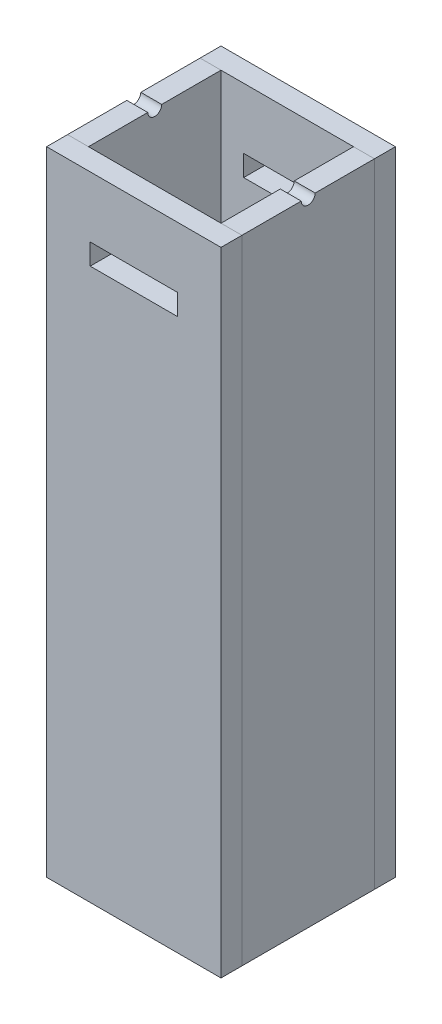
from build123d import *

# Parameters (mm, degrees)
ESBO_O1_W             = 50
ESBO_O1_H             = 6
PAREDE_1_DEPTH        = 181.4148
PAREDE_1_2_DEPTH      = 181.4148
ESBO_O4_W             = 6
ESBO_O4_H             = 181.4148
PAREDE_2_DEPTH        = 38
PAREDE_2_2_DEPTH      = 38
CORTE_TUBO_START      = -50
ESBO_O5_R             = 2
CORTE_TUBO_DEPTH      = 50
CORTE_EXTRUS_O1_START = -50
ESBO_O7_W             = 25
ESBO_O7_H             = 6
CORTE_EXTRUS_O1_DEPTH = 50


with BuildPart() as part:
    # Esboço1 → parede_1 (new body)
    with BuildSketch(Plane(origin=(0, 0, 0), x_dir=(1, 0, 0), z_dir=(0, 1, 0))):
        with Locations((-2.45569837, 22)):
            Rectangle(ESBO_O1_W, ESBO_O1_H)
    extrude(amount=PAREDE_1_DEPTH)


with BuildPart() as body_2:
    # Esboço1 → parede_1 2 (new body)
    with BuildSketch(Plane(origin=(0, 0, 0), x_dir=(1, 0, 0), z_dir=(0, 1, 0))):
        with Locations((-2.45569837, -22)):
            Rectangle(ESBO_O1_W, ESBO_O1_H)
    extrude(amount=PAREDE_1_2_DEPTH)


with BuildPart() as body_3:
    # Esboço4 → parede_2 (new body)
    with BuildSketch(Plane.XY.offset(-19)):
        with Locations((19.54430163, 90.7074)):
            Rectangle(ESBO_O4_W, ESBO_O4_H)
    extrude(amount=PAREDE_2_DEPTH)


with BuildPart() as body_4:
    # Esboço4 → parede_2 2 (new body)
    with BuildSketch(Plane.XY.offset(-19)):
        with Locations((-24.45569837, 90.7074)):
            Rectangle(ESBO_O4_W, ESBO_O4_H)
    extrude(amount=PAREDE_2_2_DEPTH)


with BuildPart() as corte_tubo_tool:
    # Esboço5 → Corte_tubo (new body)
    with BuildSketch(Plane(origin=(22.54430163, 0, 0), x_dir=(0, 0, -1), z_dir=(1, 0, 0)).offset(CORTE_TUBO_START)):
        with Locations((0, 181.4148)):
            Circle(ESBO_O5_R)
    extrude(amount=CORTE_TUBO_DEPTH)


with BuildPart() as body_3_1:
    add(body_3.part)

    # Corte_tubo: cut by corte_tubo_tool
    add(corte_tubo_tool.part, mode=Mode.SUBTRACT)


with BuildPart() as body_4_1:
    add(body_4.part)

    # Corte_tubo: cut by corte_tubo_tool
    add(corte_tubo_tool.part, mode=Mode.SUBTRACT)


with BuildPart() as corte_extrus_o1_tool:
    # Esboço7 → Corte-extrusão1 (new body)
    with BuildSketch(Plane.XY.offset(25).offset(CORTE_EXTRUS_O1_START)):
        with Locations((-2.45569837, 161)):
            Rectangle(ESBO_O7_W, ESBO_O7_H)
    extrude(amount=CORTE_EXTRUS_O1_DEPTH)


with BuildPart() as part_1:
    add(part.part)

    # Corte-extrusão1: cut by corte_extrus_o1_tool
    add(corte_extrus_o1_tool.part, mode=Mode.SUBTRACT)


with BuildPart() as body_2_1:
    add(body_2.part)

    # Corte-extrusão1: cut by corte_extrus_o1_tool
    add(corte_extrus_o1_tool.part, mode=Mode.SUBTRACT)


solid = Compound([body_3_1.part, body_4_1.part, part_1.part, body_2_1.part])
